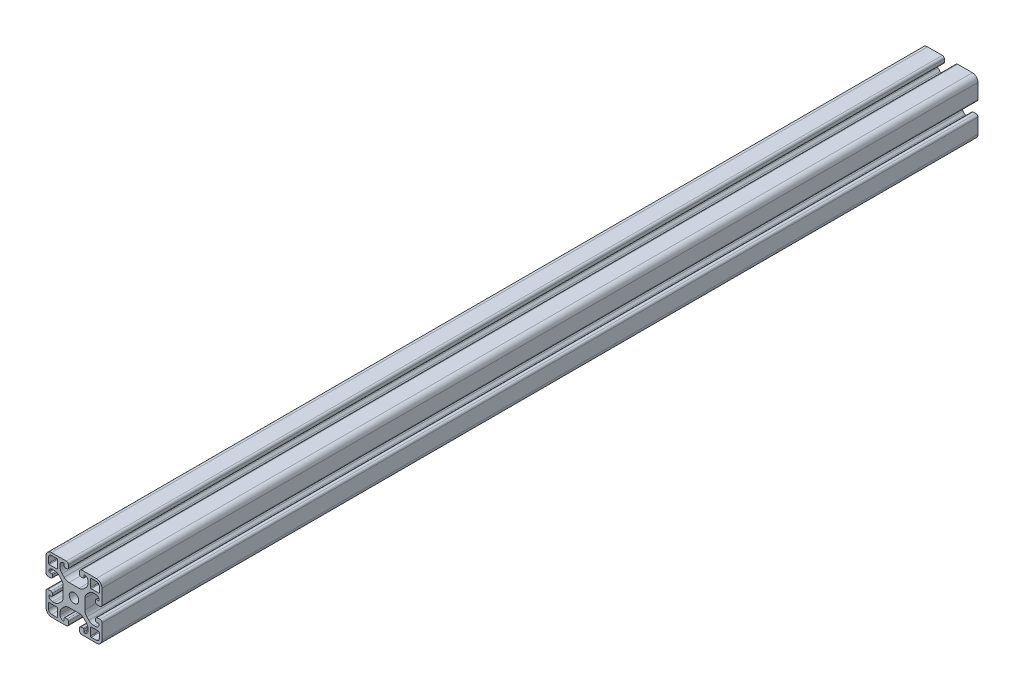
from build123d import *

# Parameters (mm, degrees)
ESQUISSE1_R        = 3.4
BOSS_EXTRU_1_DEPTH = 626


with BuildPart() as part:
    # Esquisse1 → Boss.-Extru.1 (new body)
    with BuildSketch(Plane(origin=(0, 0, -30), x_dir=(-1, 0, 0), z_dir=(0, 0, -1))):
        with BuildLine():
            Line((-4.5, 15), (-4.5, 13.5))
            ThreePointArc((-4.5, 13.5), (-4.353553391, 13.146446609), (-4, 13))
            Line((-4, 13), (-2.5, 13))
            ThreePointArc((-2.5, 13), (-2.146446609, 12.853553391), (-2, 12.5))
            ThreePointArc((-2, 12.5), (-2.732233047, 10.732233047), (-4.5, 10))
            Line((-4.5, 10), (-5.807611845, 10))
            ThreePointArc((-5.807611845, 10), (-7.721029006, 10.380602337), (-9.343145751, 11.464466094))
            Line((-9.343145751, 11.464466094), (-10.785533906, 12.906854249))
            ThreePointArc((-10.785533906, 12.906854249), (-11.869397663, 14.528970994), (-12.25, 16.442388155))
            Line((-12.25, 16.442388155), (-12.25, 23.557611845))
            ThreePointArc((-12.25, 23.557611845), (-11.869397663, 25.471029006), (-10.785533906, 27.093145751))
            Line((-10.785533906, 27.093145751), (-9.343145751, 28.535533906))
            ThreePointArc((-9.343145751, 28.535533906), (-7.721029006, 29.619397663), (-5.807611845, 30))
            Line((-5.807611845, 30), (-4.5, 30))
            ThreePointArc((-4.5, 30), (-2.732233047, 29.267766953), (-2, 27.5))
            ThreePointArc((-2, 27.5), (-2.146446609, 27.146446609), (-2.5, 27))
            Line((-2.5, 27), (-4, 27))
            ThreePointArc((-4, 27), (-4.353553391, 26.853553391), (-4.5, 26.5))
            Line((-4.5, 26.5), (-4.5, 25))
            ThreePointArc((-4.5, 25), (-4.207106781, 24.292893219), (-3.5, 24))
            Line((-3.5, 24), (-1.5, 24))
            ThreePointArc((-1.5, 24), (-0.439339828, 24.439339828), (0, 25.5))
            Line((0, 25.5), (0, 36))
            ThreePointArc((0, 36), (-1.171572875, 38.828427125), (-4, 40))
            Line((-4, 40), (-14.5, 40))
            ThreePointArc((-14.5, 40), (-15.560660172, 39.560660172), (-16, 38.5))
            Line((-16, 38.5), (-16, 36.5))
            ThreePointArc((-16, 36.5), (-15.707106781, 35.792893219), (-15, 35.5))
            Line((-15, 35.5), (-13.5, 35.5))
            ThreePointArc((-13.5, 35.5), (-13.146446609, 35.646446609), (-13, 36))
            Line((-13, 36), (-13, 37.5))
            ThreePointArc((-13, 37.5), (-12.853553391, 37.853553391), (-12.5, 38))
            ThreePointArc((-12.5, 38), (-10.732233047, 37.267766953), (-10, 35.5))
            Line((-10, 35.5), (-10, 34.192388155))
            ThreePointArc((-10, 34.192388155), (-10.380602337, 32.278970994), (-11.464466094, 30.656854249))
            Line((-11.464466094, 30.656854249), (-12.906854249, 29.214466094))
            ThreePointArc((-12.906854249, 29.214466094), (-14.528970994, 28.130602337), (-16.442388155, 27.75))
            Line((-16.442388155, 27.75), (-23.557611845, 27.75))
            ThreePointArc((-23.557611845, 27.75), (-25.471029006, 28.130602337), (-27.093145751, 29.214466094))
            Line((-27.093145751, 29.214466094), (-28.535533906, 30.656854249))
            ThreePointArc((-28.535533906, 30.656854249), (-29.619397663, 32.278970994), (-30, 34.192388155))
            Line((-30, 34.192388155), (-30, 35.5))
            ThreePointArc((-30, 35.5), (-29.267766953, 37.267766953), (-27.5, 38))
            ThreePointArc((-27.5, 38), (-27.146446609, 37.853553391), (-27, 37.5))
            Line((-27, 37.5), (-27, 36))
            ThreePointArc((-27, 36), (-26.853553391, 35.646446609), (-26.5, 35.5))
            Line((-26.5, 35.5), (-25, 35.5))
            ThreePointArc((-25, 35.5), (-24.292893219, 35.792893219), (-24, 36.5))
            Line((-24, 36.5), (-24, 38.5))
            ThreePointArc((-24, 38.5), (-24.439339828, 39.560660172), (-25.5, 40))
            Line((-25.5, 40), (-36, 40))
            ThreePointArc((-36, 40), (-38.828427125, 38.828427125), (-40, 36))
            Line((-40, 36), (-40, 25.5))
            ThreePointArc((-40, 25.5), (-39.560660172, 24.439339828), (-38.5, 24))
            Line((-38.5, 24), (-36.5, 24))
            ThreePointArc((-36.5, 24), (-35.792893219, 24.292893219), (-35.5, 25))
            Line((-35.5, 25), (-35.5, 26.5))
            ThreePointArc((-35.5, 26.5), (-35.646446609, 26.853553391), (-36, 27))
            Line((-36, 27), (-37.5, 27))
            ThreePointArc((-37.5, 27), (-37.853553391, 27.146446609), (-38, 27.5))
            ThreePointArc((-38, 27.5), (-37.267766953, 29.267766953), (-35.5, 30))
            Line((-35.5, 30), (-34.192388155, 30))
            ThreePointArc((-34.192388155, 30), (-32.278970994, 29.619397663), (-30.656854249, 28.535533906))
            Line((-30.656854249, 28.535533906), (-29.214466094, 27.093145751))
            ThreePointArc((-29.214466094, 27.093145751), (-28.130602337, 25.471029006), (-27.75, 23.557611845))
            Line((-27.75, 23.557611845), (-27.75, 16.442388155))
            ThreePointArc((-27.75, 16.442388155), (-28.130602337, 14.528970994), (-29.214466094, 12.906854249))
            Line((-29.214466094, 12.906854249), (-30.656854249, 11.464466094))
            ThreePointArc((-30.656854249, 11.464466094), (-32.278970994, 10.380602337), (-34.192388155, 10))
            Line((-34.192388155, 10), (-35.5, 10))
            ThreePointArc((-35.5, 10), (-37.267766953, 10.732233047), (-38, 12.5))
            ThreePointArc((-38, 12.5), (-37.853553391, 12.853553391), (-37.5, 13))
            Line((-37.5, 13), (-36, 13))
            ThreePointArc((-36, 13), (-35.646446609, 13.146446609), (-35.5, 13.5))
            Line((-35.5, 13.5), (-35.5, 15))
            ThreePointArc((-35.5, 15), (-35.792893219, 15.707106781), (-36.5, 16))
            Line((-36.5, 16), (-38.5, 16))
            ThreePointArc((-38.5, 16), (-39.560660172, 15.560660172), (-40, 14.5))
            Line((-40, 14.5), (-40, 4))
            ThreePointArc((-40, 4), (-38.828427125, 1.171572875), (-36, 0))
            Line((-36, 0), (-25.5, 0))
            ThreePointArc((-25.5, 0), (-24.439339828, 0.439339828), (-24, 1.5))
            Line((-24, 1.5), (-24, 3.5))
            ThreePointArc((-24, 3.5), (-24.292893219, 4.207106781), (-25, 4.5))
            Line((-25, 4.5), (-26.5, 4.5))
            ThreePointArc((-26.5, 4.5), (-26.853553391, 4.353553391), (-27, 4))
            Line((-27, 4), (-27, 2.5))
            ThreePointArc((-27, 2.5), (-27.146446609, 2.146446609), (-27.5, 2))
            ThreePointArc((-27.5, 2), (-29.267766953, 2.732233047), (-30, 4.5))
            Line((-30, 4.5), (-30, 5.807611845))
            ThreePointArc((-30, 5.807611845), (-29.619397663, 7.721029006), (-28.535533906, 9.343145751))
            Line((-28.535533906, 9.343145751), (-27.093145751, 10.785533906))
            ThreePointArc((-27.093145751, 10.785533906), (-25.471029006, 11.869397663), (-23.557611845, 12.25))
            Line((-23.557611845, 12.25), (-16.442388155, 12.25))
            ThreePointArc((-16.442388155, 12.25), (-14.528970994, 11.869397663), (-12.906854249, 10.785533906))
            Line((-12.906854249, 10.785533906), (-11.464466094, 9.343145751))
            ThreePointArc((-11.464466094, 9.343145751), (-10.380602337, 7.721029006), (-10, 5.807611845))
            Line((-10, 5.807611845), (-10, 4.5))
            ThreePointArc((-10, 4.5), (-10.732233047, 2.732233047), (-12.5, 2))
            ThreePointArc((-12.5, 2), (-12.853553391, 2.146446609), (-13, 2.5))
            Line((-13, 2.5), (-13, 4))
            ThreePointArc((-13, 4), (-13.146446609, 4.353553391), (-13.5, 4.5))
            Line((-13.5, 4.5), (-15, 4.5))
            ThreePointArc((-15, 4.5), (-15.707106781, 4.207106781), (-16, 3.5))
            Line((-16, 3.5), (-16, 1.5))
            ThreePointArc((-16, 1.5), (-15.560660172, 0.439339828), (-14.5, 0))
            Line((-14.5, 0), (-4, 0))
            ThreePointArc((-4, 0), (-1.171572875, 1.171572875), (0, 4))
            Line((0, 4), (0, 14.5))
            ThreePointArc((0, 14.5), (-0.439339828, 15.560660172), (-1.5, 16))
            Line((-1.5, 16), (-3.5, 16))
            ThreePointArc((-3.5, 16), (-4.207106781, 15.707106781), (-4.5, 15))
        make_face()
        with Locations(Location((-20, 20, 0), (0, 0, 180))):
            Circle(ESQUISSE1_R, mode=Mode.SUBTRACT)
        with BuildLine():
            Line((-4, 1.8), (-7.7, 1.8))
            ThreePointArc((-7.7, 1.8), (-8.053553391, 1.946446609), (-8.2, 2.3))
            Line((-8.2, 2.3), (-8.2, 7.7))
            ThreePointArc((-8.2, 7.7), (-8.053553391, 8.053553391), (-7.7, 8.2))
            Line((-7.7, 8.2), (-2.3, 8.2))
            ThreePointArc((-2.3, 8.2), (-1.946446609, 8.053553391), (-1.8, 7.7))
            Line((-1.8, 7.7), (-1.8, 4))
            ThreePointArc((-1.8, 4), (-2.444365081, 2.444365081), (-4, 1.8))
        make_face(mode=Mode.SUBTRACT)
        with BuildLine():
            Line((-38.2, 4), (-38.2, 7.7))
            ThreePointArc((-38.2, 7.7), (-38.053553391, 8.053553391), (-37.7, 8.2))
            Line((-37.7, 8.2), (-32.3, 8.2))
            ThreePointArc((-32.3, 8.2), (-31.946446609, 8.053553391), (-31.8, 7.7))
            Line((-31.8, 7.7), (-31.8, 2.3))
            ThreePointArc((-31.8, 2.3), (-31.946446609, 1.946446609), (-32.3, 1.8))
            Line((-32.3, 1.8), (-36, 1.8))
            ThreePointArc((-36, 1.8), (-37.555634919, 2.444365081), (-38.2, 4))
        make_face(mode=Mode.SUBTRACT)
        with BuildLine():
            Line((-36, 38.2), (-32.3, 38.2))
            ThreePointArc((-32.3, 38.2), (-31.946446609, 38.053553391), (-31.8, 37.7))
            Line((-31.8, 37.7), (-31.8, 32.3))
            ThreePointArc((-31.8, 32.3), (-31.946446609, 31.946446609), (-32.3, 31.8))
            Line((-32.3, 31.8), (-37.7, 31.8))
            ThreePointArc((-37.7, 31.8), (-38.053553391, 31.946446609), (-38.2, 32.3))
            Line((-38.2, 32.3), (-38.2, 36))
            ThreePointArc((-38.2, 36), (-37.555634919, 37.555634919), (-36, 38.2))
        make_face(mode=Mode.SUBTRACT)
        with BuildLine():
            Line((-1.8, 36), (-1.8, 32.3))
            ThreePointArc((-1.8, 32.3), (-1.946446609, 31.946446609), (-2.3, 31.8))
            Line((-2.3, 31.8), (-7.7, 31.8))
            ThreePointArc((-7.7, 31.8), (-8.053553391, 31.946446609), (-8.2, 32.3))
            Line((-8.2, 32.3), (-8.2, 37.7))
            ThreePointArc((-8.2, 37.7), (-8.053553391, 38.053553391), (-7.7, 38.2))
            Line((-7.7, 38.2), (-4, 38.2))
            ThreePointArc((-4, 38.2), (-2.444365081, 37.555634919), (-1.8, 36))
        make_face(mode=Mode.SUBTRACT)
    extrude(amount=-BOSS_EXTRU_1_DEPTH)


solid = part.part
